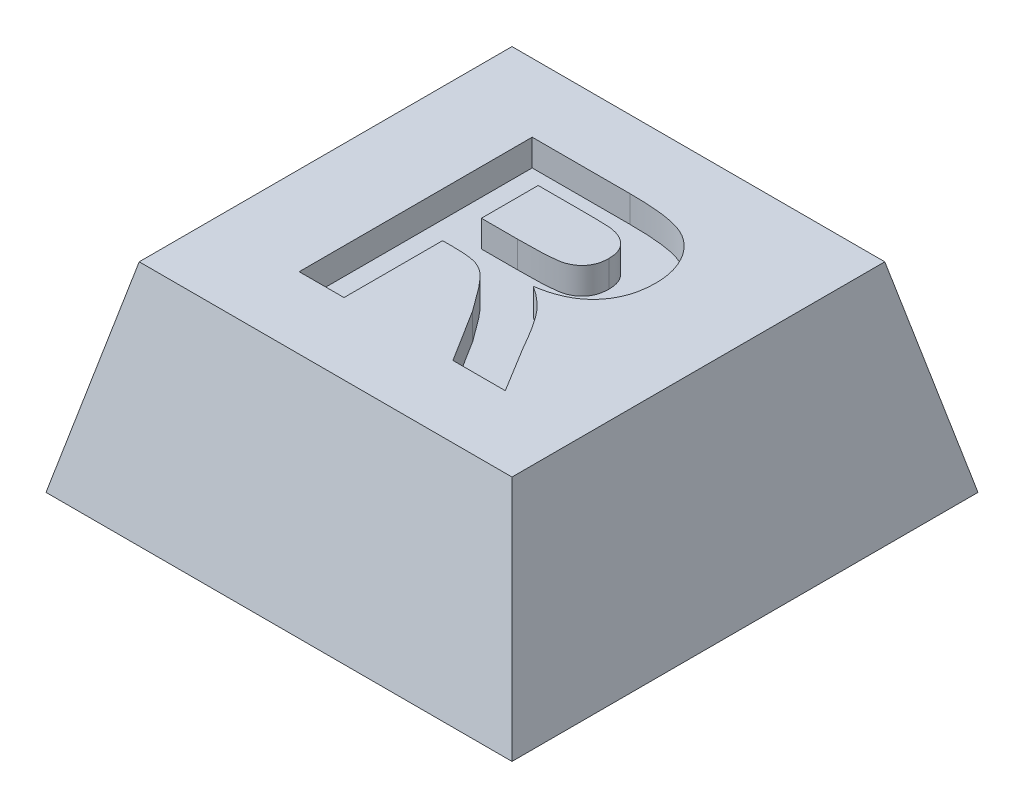
from build123d import *

# Parameters (mm, degrees)
SKETCH1_W           = 7
SKETCH1_H           = 7
BOSS_EXTRUDE1_DEPTH = 3
CUT_EXTRUDE1_DEPTH  = 7
CUT_EXTRUDE2_DEPTH  = 11
SKETCH4_R           = 1.8
CUT_EXTRUDE3_DEPTH  = 0.8
CUT_EXTRUDE4_DEPTH  = 0.4


with BuildPart() as part:
    # Sketch1 → Boss-Extrude1 (new body)
    with BuildSketch(Plane(origin=(0, 0, 0), x_dir=(1, 0, 0), z_dir=(0, 1, 0))):
        with Locations((3.5, 3.5)):
            Rectangle(SKETCH1_W, SKETCH1_H)
    extrude(amount=BOSS_EXTRUDE1_DEPTH)

    # Sketch2 → Cut-Extrude1 (cut)
    with BuildSketch(Plane.XY):
        Polygon((0, 0), (0.7, 3), (0, 3), align=None)
        Polygon((7, 0), (6.3, 3), (7, 3), align=None)
    extrude(amount=-CUT_EXTRUDE1_DEPTH, mode=Mode.SUBTRACT)

    # Sketch3 → Cut-Extrude2 (cut)
    with BuildSketch(Plane(origin=(0, 0, 0), x_dir=(0, 0, -1), z_dir=(1, 0, 0))):
        Polygon((0, 0), (0.7, 3), (0, 3), align=None)
        Polygon((7, 3), (6.3, 3), (7, 0), align=None)
    extrude(amount=CUT_EXTRUDE2_DEPTH, mode=Mode.SUBTRACT)

    # Sketch4 → Cut-Extrude3 (cut)
    with BuildSketch(Plane.XZ):
        with Locations(Location((3.5, -3.5, 0), (0, 0, 270))):
            Circle(SKETCH4_R)
    extrude(amount=-CUT_EXTRUDE3_DEPTH, mode=Mode.SUBTRACT)

    # Sketch5 → Cut-Extrude4 (cut)
    with BuildSketch(Plane(origin=(0, 3, 0), x_dir=(1, 0, 0), z_dir=(0, 1, 0))):
        with BuildLine():
            Line((2.030546131, 1.772776287), (2.030546131, 5.272776287))
            Line((2.030546131, 5.272776287), (3.499396292, 5.272776287))
            add(Edge.make_bspline(
                [(3.499396292, 5.272776287), (3.5440361, 5.272501173), (3.63006518, 5.271970977), (3.754480014, 5.268104688), (3.869218418, 5.260004585), (3.974789374, 5.250831153), (4.070685816, 5.2374844), (4.157286901, 5.221495121), (4.23444683, 5.202965752), (4.303291413, 5.180773827), (4.366063686, 5.155374398), (4.424539139, 5.125141932), (4.479360726, 5.089720882), (4.531370453, 5.050332114), (4.580788559, 5.006915106), (4.626260263, 4.958320831), (4.668577803, 4.90527287), (4.707707034, 4.848212589), (4.742177437, 4.787391941), (4.773674335, 4.724764195), (4.799313998, 4.659662899), (4.820492127, 4.592394727), (4.837409543, 4.523105729), (4.849151659, 4.451619746), (4.856482135, 4.378066169), (4.857136528, 4.328382861), (4.857469208, 4.303124845)],
                knots=[0, 0, 0, 0, 1.675828044, 3.229627355, 4.67171229, 5.993455049, 7.206927059, 8.304770529, 9.29850117, 10.183580433, 11.017754134, 11.837875825, 12.650738409, 13.464925643, 14.285328857, 15.117007378, 15.959673368, 16.830859064, 17.711229498, 18.58228265, 19.460420693, 20.334473227, 21.228207035, 22.135446768, 23.052097822, 24, 24, 24, 24], degree=3))
            add(Edge.make_bspline(
                [(4.857469208, 4.303124845), (4.856852136, 4.271306813), (4.855646207, 4.20912561), (4.844548611, 4.117987318), (4.828065847, 4.030911185), (4.804569794, 3.947776576), (4.772263199, 3.869561272), (4.734759192, 3.795169587), (4.690029362, 3.724853862), (4.638377601, 3.659311167), (4.579850151, 3.598483484), (4.51419052, 3.543622601), (4.441867499, 3.494514108), (4.362443578, 3.451441194), (4.276471789, 3.414618521), (4.18357933, 3.383637045), (4.084186726, 3.358421575), (4.015049286, 3.346556943), (3.979664721, 3.34048462)],
                knots=[0, 0, 0, 0, 1.05911256, 2.069797862, 3.05271628, 4.008392045, 4.940519534, 5.866323021, 6.779546087, 7.71056835, 8.640711998, 9.585328432, 10.554502533, 11.547017206, 12.589327225, 13.664782803, 14.804835066, 16, 16, 16, 16], degree=3))
            add(Edge.make_bspline(
                [(3.979664721, 3.34048462), (4.013885569, 3.317819831), (4.080860431, 3.27346175), (4.173524973, 3.200403435), (4.256715746, 3.123723082), (4.319703603, 3.055534143), (4.368103279, 2.995569296), (4.407073288, 2.943123463), (4.44910869, 2.882765916), (4.493797209, 2.814463953), (4.542459952, 2.738821883), (4.593287063, 2.65468189), (4.647342172, 2.562864685), (4.683685664, 2.49872572), (4.702521292, 2.46548462)],
                knots=[0, 0, 0, 0, 1.285445069, 2.515791127, 3.691898215, 4.826622834, 5.420063933, 6.105349801, 6.873086501, 7.723915395, 8.66222816, 9.690593598, 10.803111229, 12, 12, 12, 12], degree=3))
            Line((4.702521292, 2.46548462), (5.126699978, 1.772776287))
            Line((5.126699978, 1.772776287), (4.340041324, 1.772776287))
            Line((4.340041324, 1.772776287), (3.842244849, 2.56714728))
            add(Edge.make_bspline(
                [(3.842244849, 2.56714728), (3.819383068, 2.598961265), (3.775735226, 2.659700703), (3.71272687, 2.746013416), (3.655079817, 2.822847232), (3.604328246, 2.891315046), (3.55790415, 2.949475634), (3.517217149, 2.998342534), (3.483095985, 3.038964357), (3.444487802, 3.079242648), (3.399571281, 3.120637513), (3.343968216, 3.16077219), (3.286869026, 3.192767131), (3.225691806, 3.217180023), (3.154942198, 3.234202313), (3.069889966, 3.245047676), (2.967860868, 3.253049263), (2.894114271, 3.253371714), (2.85436424, 3.253545518)],
                knots=[0, 0, 0, 0, 1.465447777, 2.797841088, 3.997266218, 5.05856206, 5.985598736, 6.780315439, 7.437430484, 7.969193402, 8.866571936, 9.718200644, 10.52825214, 11.309096006, 12.174169268, 13.242355782, 14.513606761, 16, 16, 16, 16], degree=3))
            Line((2.85436424, 3.253545518), (2.703623054, 3.253545518))
            Line((2.703623054, 3.253545518), (2.703623054, 1.772776287))
            Line((2.703623054, 1.772776287), (2.030546131, 1.772776287))
        make_face()
        with BuildLine():
            Line((2.703623054, 3.836878851), (3.245590202, 3.836878851))
            add(Edge.make_bspline(
                [(3.245590202, 3.836878851), (3.287425822, 3.836968507), (3.367129748, 3.837139318), (3.480470316, 3.839613437), (3.581721608, 3.841713365), (3.670277711, 3.846989524), (3.746534832, 3.852218694), (3.810187065, 3.859014719), (3.861770698, 3.867047401), (3.913294077, 3.879536112), (3.966071524, 3.901295225), (4.022322296, 3.932286607), (4.070398439, 3.972490835), (4.112043483, 4.018970988), (4.143812817, 4.073612635), (4.16869572, 4.133981429), (4.181311879, 4.201418818), (4.183343969, 4.24816171), (4.184392285, 4.272275486)],
                knots=[0, 0, 0, 0, 1.697953026, 3.23488743, 4.60134403, 5.807846676, 6.835100678, 7.703488618, 8.405232423, 8.952775585, 9.851109663, 10.713519226, 11.549115941, 12.382556273, 13.233359028, 14.101746968, 15.020727134, 16, 16, 16, 16], degree=3))
            add(Edge.make_bspline(
                [(4.184392285, 4.272275486), (4.183200022, 4.299251728), (4.180899743, 4.351298039), (4.162759412, 4.425360435), (4.131096203, 4.490784365), (4.0876106, 4.547677846), (4.033021276, 4.595719522), (3.967999354, 4.633854155), (3.893027901, 4.662255248), (3.838953649, 4.672743717), (3.810694369, 4.678225005)],
                knots=[0, 0, 0, 0, 1.062977961, 2.050844577, 2.982300261, 3.90936959, 4.856017476, 5.831122378, 6.86654153, 8, 8, 8, 8], degree=3))
            add(Edge.make_bspline(
                [(3.810694369, 4.678225005), (3.801353235, 4.679251395), (3.779212787, 4.681684154), (3.74011538, 4.683246609), (3.690124331, 4.685648271), (3.628634545, 4.686629777), (3.556195371, 4.688350271), (3.472518757, 4.688666197), (3.377870551, 4.689675558), (3.311028641, 4.689523327), (3.275738439, 4.689442953)],
                knots=[0, 0, 0, 0, 0.42127143, 0.998501726, 1.753681744, 2.66564073, 3.755712164, 5.002818897, 6.417592707, 8, 8, 8, 8], degree=3))
            Line((3.275738439, 4.689442953), (2.703623054, 4.689442953))
            Line((2.703623054, 4.689442953), (2.703623054, 3.836878851))
        make_face(mode=Mode.SUBTRACT)
    extrude(amount=-CUT_EXTRUDE4_DEPTH, mode=Mode.SUBTRACT)


solid = part.part
